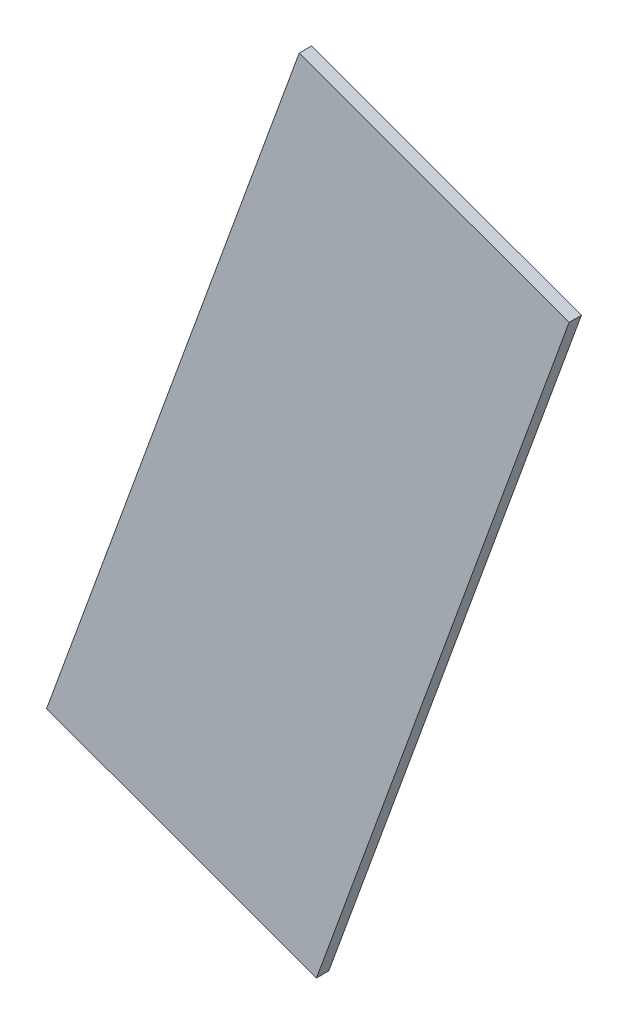
from build123d import *

# Parameters (mm, degrees)
EXTRUDE_1_DEPTH = 3


with BuildPart() as part:
    # 草图1 → 凸台-拉伸1 (new body)
    with BuildSketch(Plane.XY):
        Polygon((385.602183987, 660.225187332), (447.165809786, 829.369859073), (381.387326331, 853.311269106), (319.823700532, 684.166597365), align=None)
    extrude(amount=EXTRUDE_1_DEPTH)


solid = part.part
